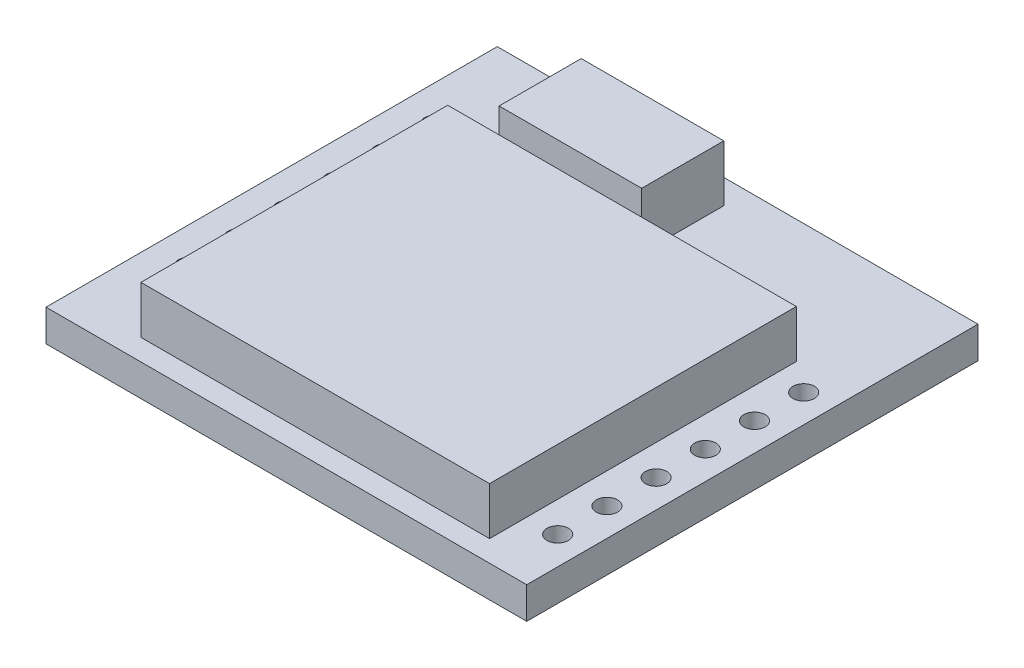
from build123d import *

# Parameters (mm, degrees)
ESQUISSE1_W        = 24.82
ESQUISSE1_H        = 23.3
ESQUISSE1_R        = 0.55
BOSS_EXTRU_1_DEPTH = 1.64
ESQUISSE2_W        = 18
ESQUISSE2_H        = 15.84
BOSS_EXTRU_2_DEPTH = 2.46
ESQUISSE3_W        = 7.36
ESQUISSE3_H        = 4.24
BOSS_EXTRU_3_DEPTH = 2.9
ESQUISSE4_W        = 4.5
ESQUISSE4_H        = 1.4
BOSS_EXTRU_4_DEPTH = 1.4


with BuildPart() as part:
    # Esquisse1 → Boss.-Extru.1 (new body)
    with BuildSketch(Plane(origin=(0, 0, 0), x_dir=(1, 0, 0), z_dir=(0, 1, 0))):
        with Locations((12.41, 11.65)):
            Rectangle(ESQUISSE1_W, ESQUISSE1_H)
        with Locations(Location((1.85, 5.55, 0), (0, 0, 270))):
            Circle(ESQUISSE1_R, mode=Mode.SUBTRACT)
        with Locations(Location((23.37, 3.05, 0), (0, 0, 270))):
            Circle(ESQUISSE1_R, mode=Mode.SUBTRACT)
        with Locations(Location((1.85, 8.09, 0), (0, 0, 270))):
            Circle(ESQUISSE1_R, mode=Mode.SUBTRACT)
        with Locations(Location((23.37, 5.59, 0), (0, 0, 270))):
            Circle(ESQUISSE1_R, mode=Mode.SUBTRACT)
        with Locations(Location((1.85, 10.63, 0), (0, 0, 270))):
            Circle(ESQUISSE1_R, mode=Mode.SUBTRACT)
        with Locations(Location((23.37, 8.13, 0), (0, 0, 270))):
            Circle(ESQUISSE1_R, mode=Mode.SUBTRACT)
        with Locations(Location((1.85, 13.17, 0), (0, 0, 270))):
            Circle(ESQUISSE1_R, mode=Mode.SUBTRACT)
        with Locations(Location((23.37, 10.67, 0), (0, 0, 270))):
            Circle(ESQUISSE1_R, mode=Mode.SUBTRACT)
        with Locations(Location((1.85, 15.71, 0), (0, 0, 270))):
            Circle(ESQUISSE1_R, mode=Mode.SUBTRACT)
        with Locations(Location((23.37, 13.21, 0), (0, 0, 270))):
            Circle(ESQUISSE1_R, mode=Mode.SUBTRACT)
        with Locations(Location((1.85, 18.25, 0), (0, 0, 270))):
            Circle(ESQUISSE1_R, mode=Mode.SUBTRACT)
        with Locations(Location((23.37, 15.75, 0), (0, 0, 270))):
            Circle(ESQUISSE1_R, mode=Mode.SUBTRACT)
    extrude(amount=BOSS_EXTRU_1_DEPTH)

    # Esquisse2 → Boss.-Extru.2 (add)
    with BuildSketch(Plane(origin=(0, 1.64, 0), x_dir=(1, 0, 0), z_dir=(0, 1, 0))):
        with Locations((12.8, 9.02)):
            Rectangle(ESQUISSE2_W, ESQUISSE2_H)
    extrude(amount=BOSS_EXTRU_2_DEPTH)

    # Esquisse3 → Boss.-Extru.3 (add)
    with BuildSketch(Plane(origin=(0, 1.64, 0), x_dir=(1, 0, 0), z_dir=(0, 1, 0))):
        with Locations((9.281405269, 19.914341586)):
            Rectangle(ESQUISSE3_W, ESQUISSE3_H)
    extrude(amount=BOSS_EXTRU_3_DEPTH)

    # Esquisse4 → Boss.-Extru.4 (add)
    with BuildSketch(Plane.XZ):
        Polygon((15.72, -7.6), (4.92, -7.6), (4.92, -23.3), (20.22, -23.3), (20.22, -7.6), align=None)
        with Locations((17.97, -6.9)):
            Rectangle(ESQUISSE4_W, ESQUISSE4_H)
    extrude(amount=BOSS_EXTRU_4_DEPTH)


solid = part.part
